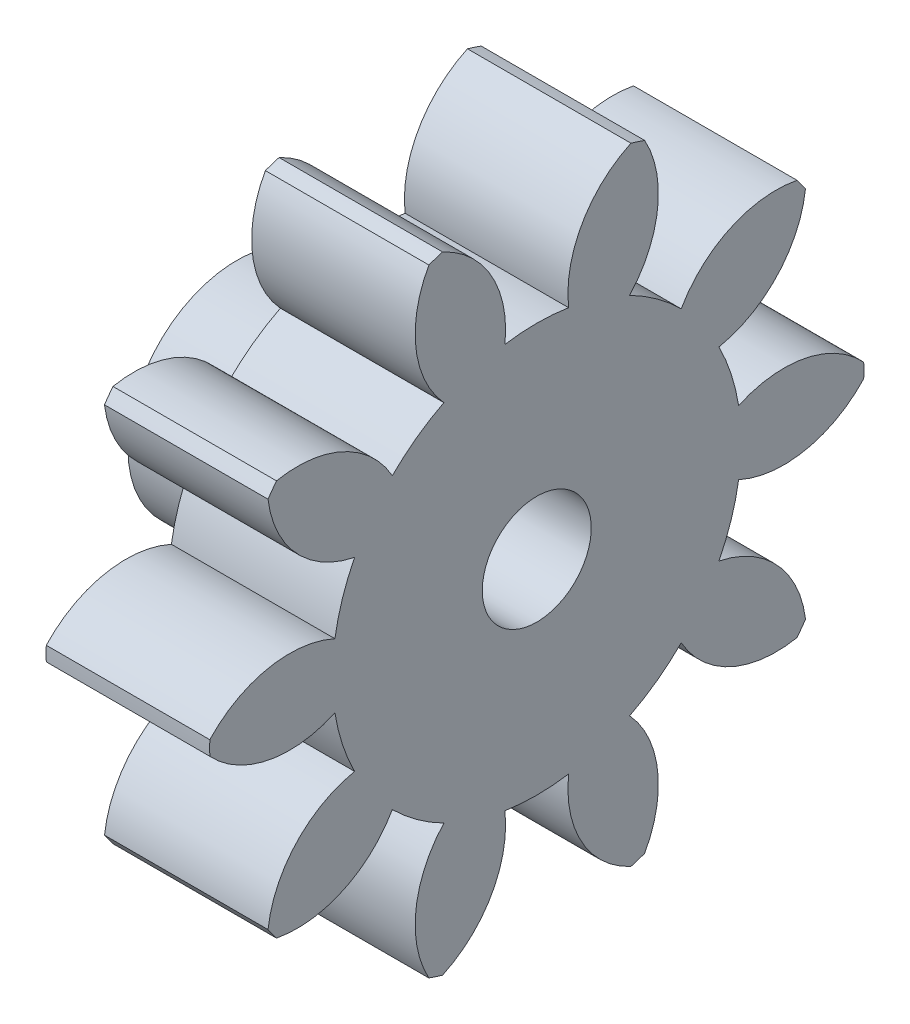
from build123d import *

# Parameters (mm, degrees)
BASPROSKE_W        = 12
BASPROSKE_H        = 24
TOOTHCUT_DEPTH     = 37
TEETHCUTS_COUNT    = 10
TEETHCUTS_ANGLE    = 324
HUBNEAONESKE_R     = 8
HUBNEARONE_DEPTH   = 38.0000508
BORSKE_R           = 4
BORE_DEPTH         = 12.0000508
SKETCH1_R          = 10.27069338
CUT_EXTRUDE1_DEPTH = 43


with BuildPart() as part:
    # BasProSke → Base-Revolve (revolve)
    with BuildSketch(Plane(origin=(0, 0, 0), x_dir=(1, 0, 0), z_dir=(0, 1, 0)), mode=Mode.PRIVATE) as base_revolve_sk:
        with Locations((6, 12)):
            Rectangle(BASPROSKE_W, BASPROSKE_H)
    revolve(base_revolve_sk.sketch.rotate(Axis((-10, 0, 0), (1, 0, 0)), 180), axis=Axis((-10, 0, 0), (1, 0, 0)))

    # TooCutSke → ToothCut (cut, through all)
    with BuildSketch(Plane(origin=(0, 0, 0), x_dir=(0, 0, -1), z_dir=(1, 0, 0))):
        with BuildLine():
            ThreePointArc((2.33803632, 14.815653451), (0, 14.999), (-2.33803632, 14.815653451))
            ThreePointArc((-2.33803632, 14.815653451), (-3.315013319, 19.654913653), (-6.946609122, 22.999227528))
            ThreePointArc((-6.946609122, 22.999227528), (0, 24.0254), (6.946609122, 22.999227528))
            ThreePointArc((6.946609122, 22.999227528), (3.315013319, 19.654913653), (2.33803632, 14.815653451))
        make_face()
    toothcut = extrude(amount=TOOTHCUT_DEPTH, mode=Mode.SUBTRACT)

    # TeethCuts: ToothCut ×10 about axis
    teethcuts_axis = Axis((-10, 0, 0), (1, 0, 0))
    for i in range(1, TEETHCUTS_COUNT):
        add(toothcut.rotate(teethcuts_axis, i * TEETHCUTS_ANGLE / (TEETHCUTS_COUNT - 1)), mode=Mode.SUBTRACT)

    # HubNeaOneSke → HubNearOne (add)
    with BuildSketch(Plane.ZY):
        with Locations(Location((0, 0, 0), (0, 0, 180))):
            Circle(HUBNEAONESKE_R)
    extrude(amount=HUBNEARONE_DEPTH)

    # BorSke → Bore (cut, symmetric)
    with BuildSketch(Plane(origin=(0, 0, 0), x_dir=(0, 0, -1), z_dir=(1, 0, 0))):
        with Locations(Location((0, 0, 0), (0, 0, 180))):
            Circle(BORSKE_R)
    extrude(amount=BORE_DEPTH, both=True, mode=Mode.SUBTRACT)

    # Sketch1 → Cut-Extrude1 (cut)
    with BuildSketch(Plane.ZY.offset(10)):
        Circle(SKETCH1_R)
    extrude(amount=CUT_EXTRUDE1_DEPTH, mode=Mode.SUBTRACT)


solid = part.part
